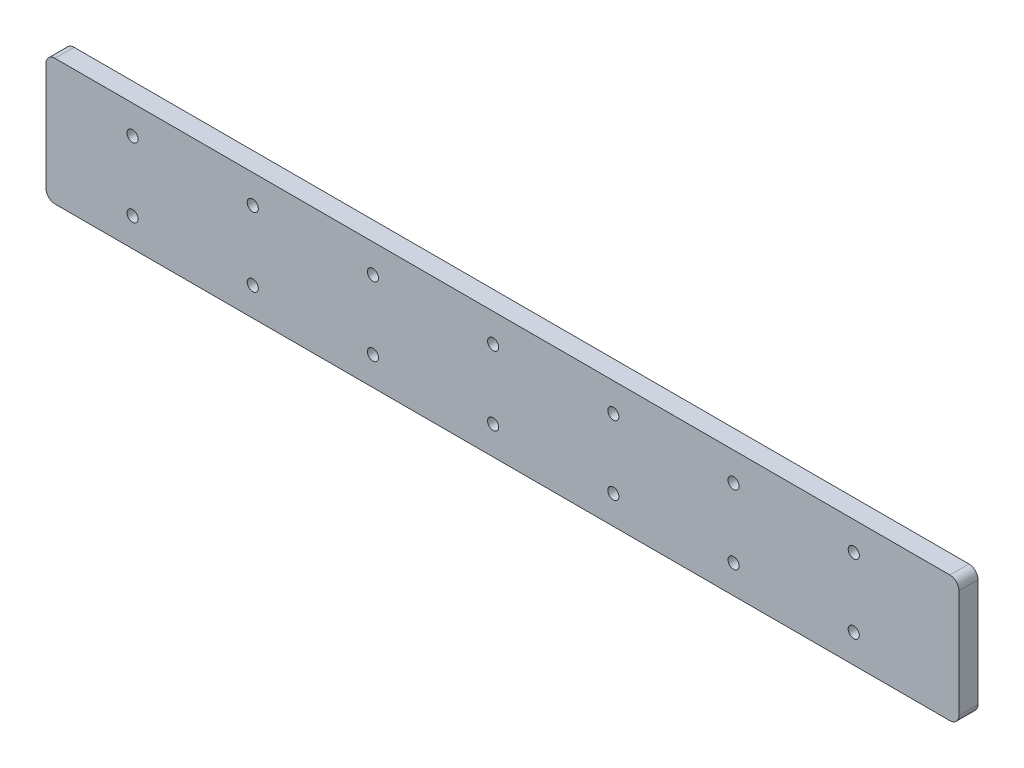
from build123d import *

# Parameters (mm, degrees)
SKETCH1_W           = 303.8
SKETCH1_H           = 42
SKETCH1_R           = 1.85
BOSS_EXTRUDE1_DEPTH = 6.35
FILLET1_R           = 3


with BuildPart() as part:
    # Sketch1 → Boss-Extrude1 (new body)
    with BuildSketch(Plane.XY):
        with Locations((-151.9, 0)):
            Rectangle(SKETCH1_W, SKETCH1_H)
        with Locations((-35, 11.5)):
            Circle(SKETCH1_R, mode=Mode.SUBTRACT)
        with Locations((-75, 11.5)):
            Circle(SKETCH1_R, mode=Mode.SUBTRACT)
        with Locations((-115, 11.5)):
            Circle(SKETCH1_R, mode=Mode.SUBTRACT)
        with Locations((-155, 11.5)):
            Circle(SKETCH1_R, mode=Mode.SUBTRACT)
        with Locations((-195, 11.5)):
            Circle(SKETCH1_R, mode=Mode.SUBTRACT)
        with Locations((-235, 11.5)):
            Circle(SKETCH1_R, mode=Mode.SUBTRACT)
        with Locations((-275, 11.5)):
            Circle(SKETCH1_R, mode=Mode.SUBTRACT)
        with Locations(Location((-275, -11.5, 0), (0, 0, 180))):
            Circle(SKETCH1_R, mode=Mode.SUBTRACT)
        with Locations(Location((-235, -11.5, 0), (0, 0, 180))):
            Circle(SKETCH1_R, mode=Mode.SUBTRACT)
        with Locations(Location((-195, -11.5, 0), (0, 0, 180))):
            Circle(SKETCH1_R, mode=Mode.SUBTRACT)
        with Locations(Location((-155, -11.5, 0), (0, 0, 180))):
            Circle(SKETCH1_R, mode=Mode.SUBTRACT)
        with Locations(Location((-115, -11.5, 0), (0, 0, 180))):
            Circle(SKETCH1_R, mode=Mode.SUBTRACT)
        with Locations(Location((-75, -11.5, 0), (0, 0, 180))):
            Circle(SKETCH1_R, mode=Mode.SUBTRACT)
        with Locations(Location((-35, -11.5, 0), (0, 0, 180))):
            Circle(SKETCH1_R, mode=Mode.SUBTRACT)
    extrude(amount=BOSS_EXTRUDE1_DEPTH)

    # Fillet1
    fillet1_edges = [part.edges().sort_by_distance(p)[0] for p in [
        (0, -21, 3.175),
        (-303.8, -21, 3.175),
        (-303.8, 21, 3.175),
        (0, 21, 3.175),
    ]]
    fillet(fillet1_edges, radius=FILLET1_R)


solid = part.part
